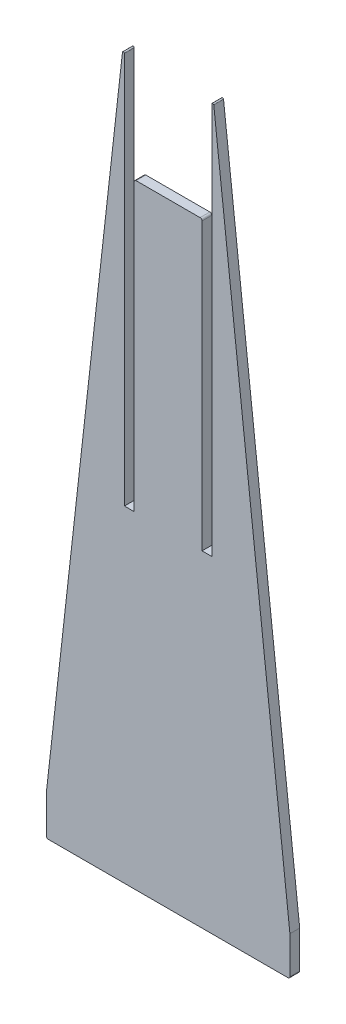
from build123d import *

# Parameters (mm, degrees)
BOSS_EXTRUDE1_DEPTH = 2.5
FILLET1_R           = 1
FILLET2_R           = 0.5


with BuildPart() as part:
    # Sketch3 → Boss-Extrude1 (new, symmetric)
    with BuildSketch(Plane.XY):
        Polygon((-22.35, 376.5), (-62.3, 20), (-62.3, 0), (62.3, 0), (62.3, 20), (22.35, 376.5), (22.35, 167.1), (17.35, 167.1), (17.35, 314.2), (-17.35, 314.2), (-17.35, 167.1), (-22.35, 167.1), align=None)
    extrude(amount=BOSS_EXTRUDE1_DEPTH, both=True)

    # Fillet1
    fillet1_edges = [part.edges().sort_by_distance(p)[0] for p in [
        (-17.35, 314.2, 0),
        (17.35, 314.2, 0),
        (62.3, 0, 0),
        (-62.3, 0, 0),
    ]]
    fillet(fillet1_edges, radius=FILLET1_R)

    # Fillet2
    fillet2_edges = [part.edges().sort_by_distance(p)[0] for p in [
        (22.35, 376.5, 0),
        (-22.35, 376.5, 0),
    ]]
    fillet(fillet2_edges, radius=FILLET2_R)


solid = part.part
